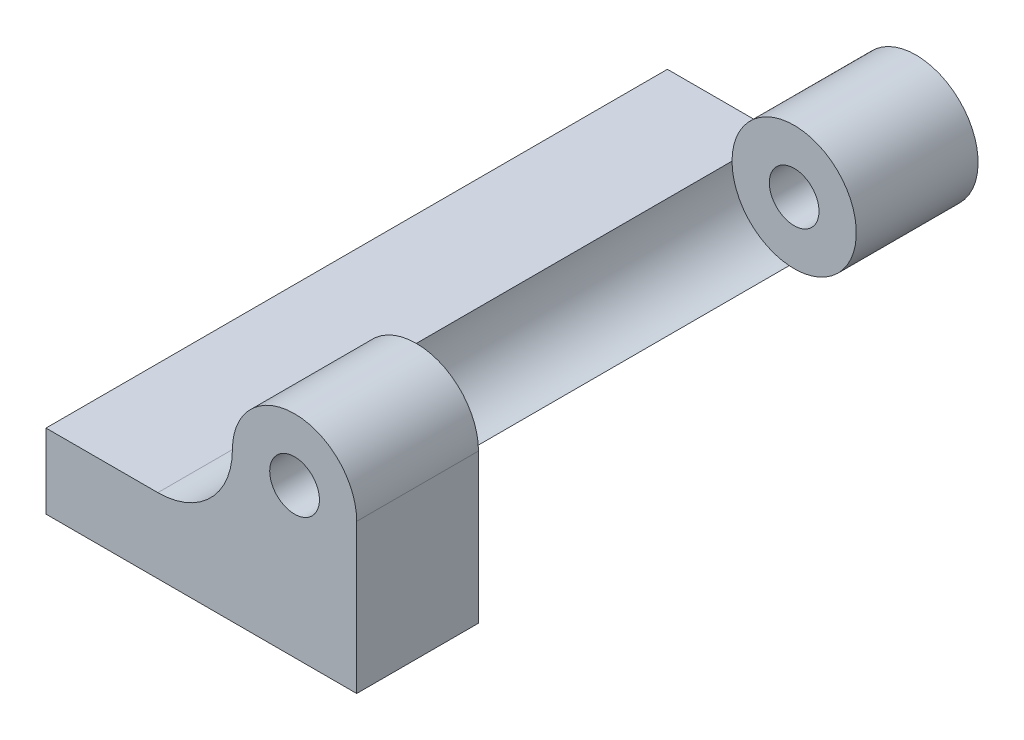
from build123d import *

# Parameters (mm, degrees)
SKETCH1_R           = 1
BOSS_EXTRUDE1_DEPTH = 25
CUT_EXTRUDE1_START  = -20.1
SKETCH2_R           = 2.5
CUT_EXTRUDE1_DEPTH  = 15.2
BOSS_EXTRUDE2_START = -4.9
BOSS_EXTRUDE2_DEPTH = 4.9


with BuildPart() as part:
    # Sketch1 → Boss-Extrude1 (new body)
    with BuildSketch(Plane.XY):
        with BuildLine():
            Line((-3, -1.5), (3, -1.5))
            ThreePointArc((3, -1.5), (4.132206562, 1.085942892), (6.800319489, 2.00798722))
            ThreePointArc((6.800319489, 2.00798722), (8.837008612, 6.195700257), (4.5, 4.5))
            ThreePointArc((4.5, 4.5), (3.621320344, 2.378679656), (1.5, 1.5))
            Line((1.5, 1.5), (-3, 1.5))
            Line((-3, 1.5), (-3, -1.5))
        make_face()
        with Locations((7, 4.5)):
            Circle(SKETCH1_R, mode=Mode.SUBTRACT)
    extrude(amount=BOSS_EXTRUDE1_DEPTH)

    # Sketch2 → Cut-Extrude1 (cut)
    with BuildSketch(Plane.XY.offset(25).offset(CUT_EXTRUDE1_START)):
        with Locations((7, 4.5)):
            Circle(SKETCH2_R)
    extrude(amount=CUT_EXTRUDE1_DEPTH, mode=Mode.SUBTRACT)

    # Sketch4 → Boss-Extrude2 (add)
    with BuildSketch(Plane.XY.offset(25).offset(BOSS_EXTRUDE2_START)):
        with BuildLine():
            Line((3, -1.5), (9.5, -1.5))
            Line((9.5, -1.5), (9.5, 4.5))
            ThreePointArc((9.5, 4.5), (8.695700257, 2.662991388), (6.800319489, 2.00798722))
            ThreePointArc((6.800319489, 2.00798722), (4.132206562, 1.085942892), (3, -1.5))
        make_face()
    extrude(amount=BOSS_EXTRUDE2_DEPTH)


solid = part.part
